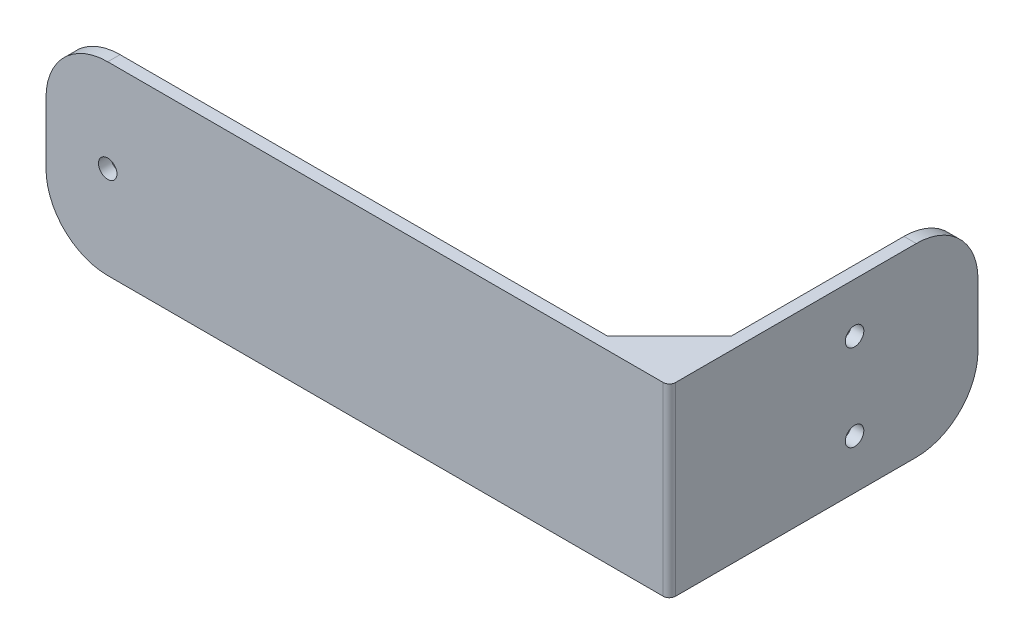
from build123d import *

# Parameters (mm, degrees)
SKETCH1_W           = 100
SKETCH1_H           = 30
SKETCH1_R           = 1.5
BOSS_EXTRUDE1_DEPTH = 2
SKETCH2_W           = 1
SKETCH2_H           = 30
BOSS_EXTRUDE3_DEPTH = 50
FILLET2_R           = 1
SKETCH3_R           = 1.5
CUT_EXTRUDE1_DEPTH  = 10
FILLET3_R           = 10
BOSS_EXTRUDE4_DEPTH = 2


with BuildPart() as part:
    # Sketch1 → Boss-Extrude1 (new body)
    with BuildSketch(Plane.XY):
        with Locations((50, 15)):
            Rectangle(SKETCH1_W, SKETCH1_H)
        with Locations((10, 15)):
            Circle(SKETCH1_R, mode=Mode.SUBTRACT)
    extrude(amount=BOSS_EXTRUDE1_DEPTH)

    # Sketch2 → Boss-Extrude3 (add)
    with BuildSketch(Plane.XY.offset(2)):
        with Locations((100.5, 15)):
            Rectangle(SKETCH2_W, SKETCH2_H)
        with Locations((99.5, 15)):
            Rectangle(SKETCH2_W, SKETCH2_H)
    extrude(amount=-BOSS_EXTRUDE3_DEPTH)

    # Fillet2
    fillet2_edges = [part.edges().sort_by_distance(p)[0] for p in [
        (101, 15, 2),
        (99, 15, 0),
    ]]
    fillet(fillet2_edges, radius=FILLET2_R)

    # Sketch3 → Cut-Extrude1 (cut)
    with BuildSketch(Plane(origin=(101, 0, 0), x_dir=(0, 0, -1), z_dir=(1, 0, 0))):
        with Locations(Location((28, 8, 0), (0, 0, 90))):
            Circle(SKETCH3_R)
        with Locations(Location((28, 22, 0), (0, 0, 90))):
            Circle(SKETCH3_R)
    extrude(amount=-CUT_EXTRUDE1_DEPTH, mode=Mode.SUBTRACT)

    # Fillet3
    fillet3_edges = [part.edges().sort_by_distance(p)[0] for p in [
        (100, 0, -48),
        (100, 30, -48),
        (0, 30, 1),
        (0, 0, 1),
    ]]
    fillet(fillet3_edges, radius=FILLET3_R)

    # Sketch4 → Boss-Extrude4 (add)
    with BuildSketch(Plane(origin=(0, 0, 0), x_dir=(1, 0, 0), z_dir=(0, 1, 0))):
        with BuildLine():
            Line((99, 10), (89, 0))
            Line((89, 0), (98, 0))
            ThreePointArc((98, 0), (98.707106781, 0.292893219), (99, 1))
            Line((99, 1), (99, 10))
        make_face()
    boss_extrude4 = extrude(amount=BOSS_EXTRUDE4_DEPTH)

    # Mirror1: Boss-Extrude4 across plane
    add(boss_extrude4.mirror(Plane.ZX.offset(15)))


solid = part.part
